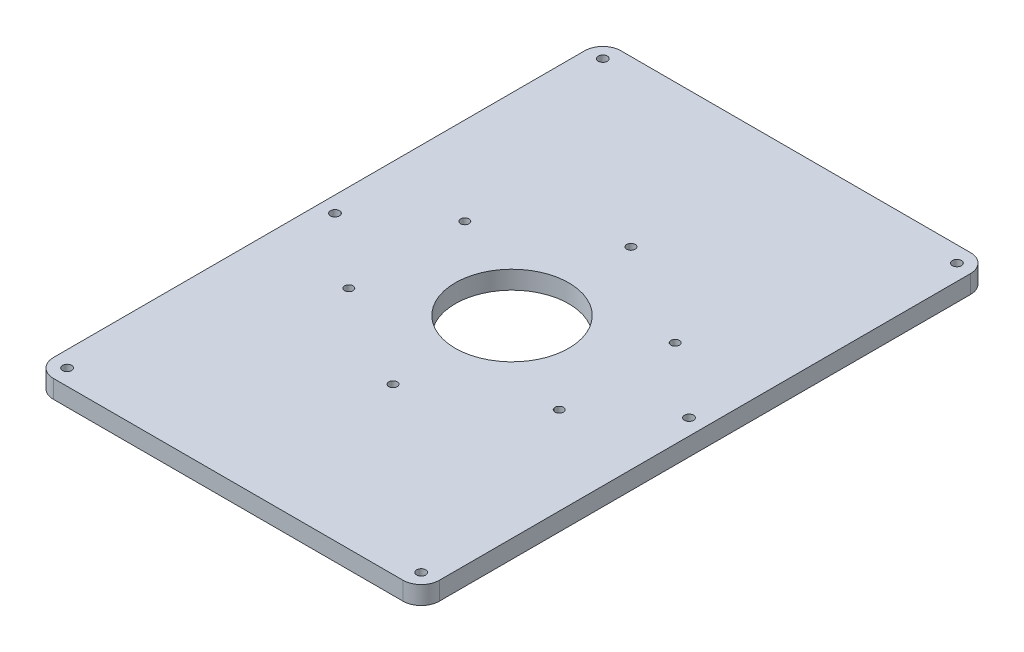
from build123d import *

# Parameters (mm, degrees)
SKETCH1_W             = 170
SKETCH1_H             = 250
BOSS_EXTRUDE1_DEPTH   = 8
SKETCH3_R             = 2
CUT_EXTRUDE2_DEPTH    = 8
FILLET1_R             = 8
CROQUIS1_R            = 25
CROQUIS1_R_2          = 1.866016506
CORTAR_EXTRUIR3_DEPTH = 10


with BuildPart() as part:
    # Sketch1 → Boss-Extrude1 (new body)
    with BuildSketch(Plane(origin=(0, 0, 0), x_dir=(1, 0, 0), z_dir=(0, 1, 0))):
        Rectangle(SKETCH1_W, SKETCH1_H)
    extrude(amount=BOSS_EXTRUDE1_DEPTH)

    # Sketch3 → Cut-Extrude2 (cut)
    with BuildSketch(Plane(origin=(0, 8, 0), x_dir=(1, 0, 0), z_dir=(0, 1, 0))):
        with Locations(Location((-78, 118, 0), (0, 0, 270))):
            Circle(SKETCH3_R)
        with Locations(Location((78, 118, 0), (0, 0, 90))):
            Circle(SKETCH3_R)
        with Locations(Location((78, -118, 0), (0, 0, 270))):
            Circle(SKETCH3_R)
        with Locations(Location((-78, -118, 0), (0, 0, 90))):
            Circle(SKETCH3_R)
        with Locations(Location((-78, 0, 0), (0, 0, 270))):
            Circle(SKETCH3_R)
        with Locations(Location((78, 0, 0), (0, 0, 90))):
            Circle(SKETCH3_R)
    extrude(amount=-CUT_EXTRUDE2_DEPTH, mode=Mode.SUBTRACT)

    # Fillet1
    fillet1_edges = [part.edges().sort_by_distance(p)[0] for p in [
        (85, 4, 125),
        (-85, 4, 125),
        (-85, 4, -125),
        (85, 4, -125),
    ]]
    fillet(fillet1_edges, radius=FILLET1_R)

    # Croquis1 → Cortar-Extruir3 (cut)
    with BuildSketch(Plane(origin=(0, 8, 0), x_dir=(1, 0, 0), z_dir=(0, 1, 0))):
        with Locations(Location((0, 0, 0), (0, 0, 270))):
            Circle(CROQUIS1_R)
        with Locations(Location((0, 52.412836982, 0), (0, 0, 270))):
            Circle(CROQUIS1_R_2)
        with Locations(Location((-46.34372748, 25.540560465, 0), (0, 0, 270))):
            Circle(CROQUIS1_R_2)
        with Locations(Location((0, -52.412836982, 0), (0, 0, 270))):
            Circle(CROQUIS1_R_2)
        with Locations(Location((-46.34372748, -25.540560465, 0), (0, 0, 270))):
            Circle(CROQUIS1_R_2)
        with Locations(Location((46.34372748, 25.540560465, 0), (0, 0, 270))):
            Circle(CROQUIS1_R_2)
        with Locations(Location((46.34372748, -25.540560465, 0), (0, 0, 270))):
            Circle(CROQUIS1_R_2)
    extrude(amount=-CORTAR_EXTRUIR3_DEPTH, mode=Mode.SUBTRACT)


solid = part.part
